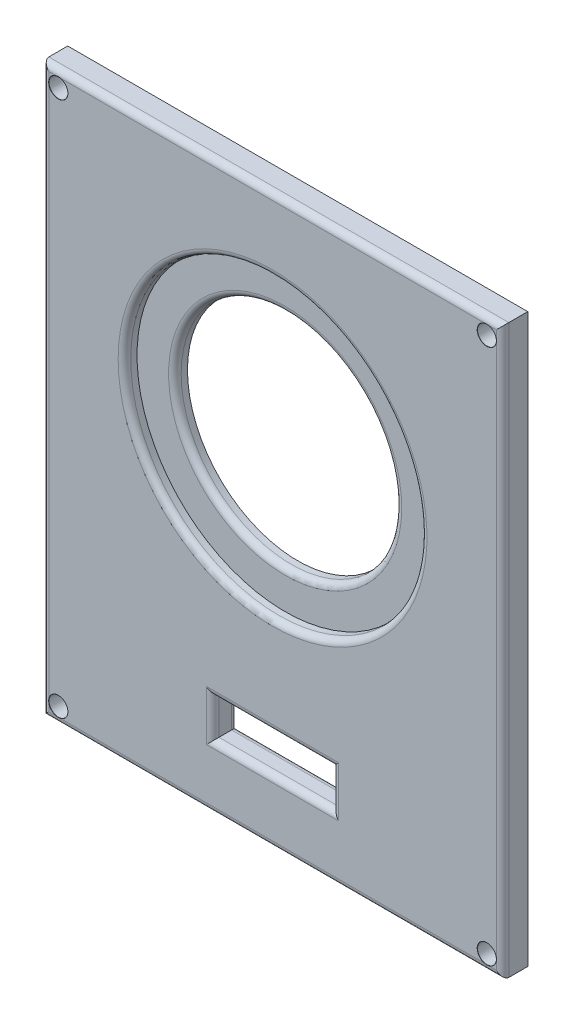
from build123d import *

# Parameters (mm, degrees)
SKETCH_1_W          = 73
SKETCH_1_H          = 90
EXTRUDE_1_DEPTH     = 4
MM_1_D              = 3
MM_1_CSINK_D        = 3.05
MM_1_CSINK_ANGLE    = 100
SKETCH_5_R          = 17.5
CUT_EXTRUDE_3_DEPTH = 116.952576513
SKETCH_9_R          = 23.5
CUT_EXTRUDE_4_DEPTH = 2
SKETCH_10_W         = 19
SKETCH_10_H         = 6
CUT_EXTRUDE_5_DEPTH = 10
FILLET_1_R          = 1


with BuildPart() as part:
    # 草图1 → 凸台-拉伸1 (new body)
    with BuildSketch(Plane.XY):
        with Locations((36.5, 45)):
            Rectangle(SKETCH_1_W, SKETCH_1_H)
    extrude(amount=EXTRUDE_1_DEPTH)

    # 大小mm 暗销孔1 (through all)
    with Locations(Plane.XY.offset(4)):
        with Locations((2.5, 2.5), (70.5, 2.5), (70.5, 87.5), (2.5, 87.5)):
            CounterSinkHole(MM_1_D / 2, MM_1_CSINK_D / 2, counter_sink_angle=MM_1_CSINK_ANGLE)

    # 草图5 → 切除-拉伸3 (cut, through all)
    with BuildSketch(Plane.XY.offset(4)):
        with Locations((36.5, 55)):
            Circle(SKETCH_5_R)
    extrude(amount=-CUT_EXTRUDE_3_DEPTH, mode=Mode.SUBTRACT)

    # 草图9 → 切除-拉伸4 (cut)
    with BuildSketch(Plane.XY.offset(4)):
        with Locations((36.5, 55)):
            Circle(SKETCH_9_R)
    extrude(amount=-CUT_EXTRUDE_4_DEPTH, mode=Mode.SUBTRACT)

    # 草图10 → 切除-拉伸5 (cut)
    with BuildSketch(Plane.XY.offset(4)):
        with Locations((36.5, 13)):
            Rectangle(SKETCH_10_W, SKETCH_10_H)
    extrude(amount=-CUT_EXTRUDE_5_DEPTH, mode=Mode.SUBTRACT)

    # 圆角1
    fillet_1_edges = [part.edges().sort_by_distance(p)[0] for p in [
        (73, 45, 4),
        (36.5, 90, 4),
        (0, 45, 4),
        (13, 55, 4),
        (19, 55, 2),
        (36.5, 10, 0),
        (46, 13, 0),
        (36.5, 16, 0),
        (27, 13, 0),
        (27, 13, 4),
        (36.5, 10, 4),
        (46, 13, 4),
        (36.5, 16, 4),
        (36.5, 0, 4),
    ]]
    fillet(fillet_1_edges, radius=FILLET_1_R)


solid = part.part
